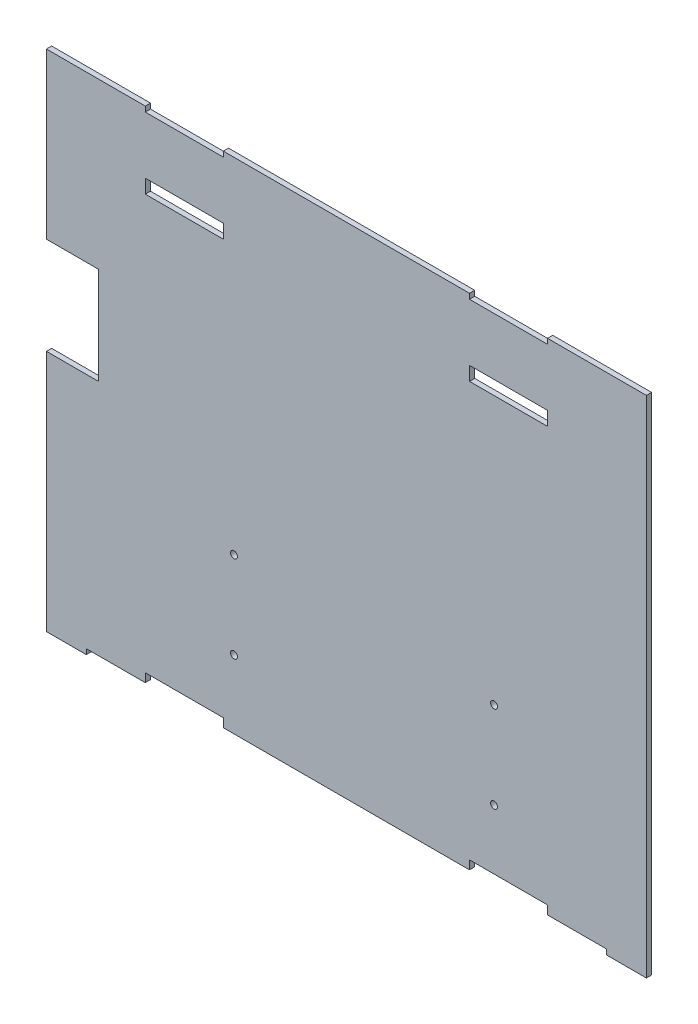
from build123d import *

# Parameters (mm, degrees)
SCHIZZO1_W                    = 45
SCHIZZO1_H                    = 8
ESTRUSIONE_ESTRUSIONE1_DEPTH  = 3
TAGLIO_ESTRUSIONE1_DEPTH      = 228.039644115
TAGLIO_ESTRUSIONE1_DEPTH_BACK = 228.039644115
SCHIZZO2_R                    = 2
SCHIZZO3_W                    = 30
SCHIZZO3_H                    = 56
TAGLIO_ESTRUSIONE2_DEPTH      = 228.039644115


with BuildPart() as part:
    # Schizzo1 → Estrusione-Estrusione1 (new body)
    with BuildSketch(Plane.XY):
        Polygon((173, -147), (173, 144), (116, 144), (116, 141), (71, 141), (71, 144), (-71, 144), (-71, 141), (-116, 141), (-116, 144), (-173, 144), (-173, -147), (-150, -147), (-150, -144), (-116, -144), (-116, -139), (-71, -139), (-71, -144), (71, -144), (71, -139), (116, -139), (116, -144), (150, -144), (150, -147), align=None)
        with Locations((93.5, 104)):
            Rectangle(SCHIZZO1_W, SCHIZZO1_H, mode=Mode.SUBTRACT)
        with Locations((-93.5, 104)):
            Rectangle(SCHIZZO1_W, SCHIZZO1_H, mode=Mode.SUBTRACT)
    extrude(amount=ESTRUSIONE_ESTRUSIONE1_DEPTH)

    # Schizzo2 → Taglio-Estrusione1 (cut, two sides: drawn at the far end of the back side and taken through both)
    with BuildSketch(Plane.XY.offset(3).offset(-TAGLIO_ESTRUSIONE1_DEPTH_BACK)):
        with Locations((-64.85, -54.5)):
            Circle(SCHIZZO2_R)
        with Locations((85.15, -54.5)):
            Circle(SCHIZZO2_R)
        with Locations((85.15, -104.5)):
            Circle(SCHIZZO2_R)
        with Locations((-64.85, -104.5)):
            Circle(SCHIZZO2_R)
    extrude(amount=TAGLIO_ESTRUSIONE1_DEPTH + TAGLIO_ESTRUSIONE1_DEPTH_BACK, mode=Mode.SUBTRACT)

    # Schizzo3 → Taglio-Estrusione2 (cut, through all)
    with BuildSketch(Plane(origin=(0, 0, 0), x_dir=(-1, 0, 0), z_dir=(0, 0, -1))):
        with Locations((158, 21)):
            Rectangle(SCHIZZO3_W, SCHIZZO3_H)
    extrude(amount=-TAGLIO_ESTRUSIONE2_DEPTH, mode=Mode.SUBTRACT)


solid = part.part
